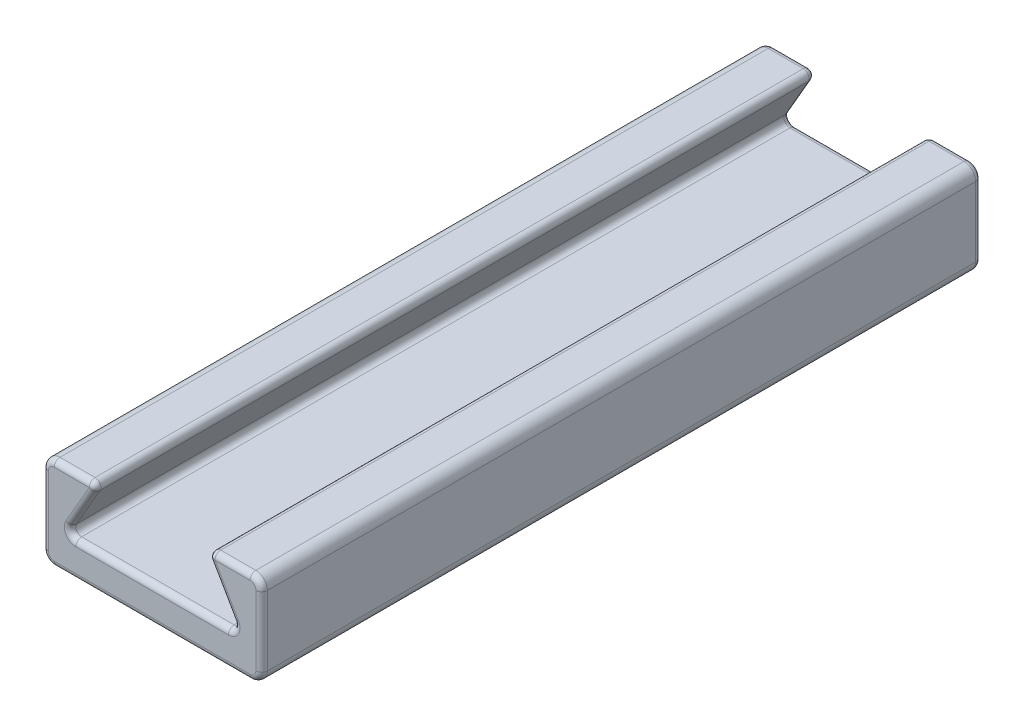
from build123d import *

# Parameters (mm, degrees)
SKETCH1_W           = 5
SKETCH1_H           = 2
BOSS_EXTRUDE1_DEPTH = 62
FILLET1_R           = 0.5
FILLET2_R           = 1
FILLET3_R           = 0.5


with BuildPart() as part:
    # Sketch1 → Boss-Extrude1 (new body)
    with BuildSketch(Plane(origin=(0, 0, 0), x_dir=(0, 1, 0), z_dir=(0, 0, 1))):
        with Locations((-2.5, -1)):
            Rectangle(SKETCH1_W, SKETCH1_H)
        Polygon((0, -4.886751346), (0, -2), (-5, -2), align=None)
        Polygon((-5, -16.87062059), (-5, -2), (-5, 0), (-8, 0), (-8, -18.87062059), (-5, -18.87062059), align=None)
        Polygon((0, -13.983869244), (-5, -16.87062059), (0, -16.87062059), align=None)
        with Locations((-2.5, -17.87062059)):
            Rectangle(SKETCH1_W, SKETCH1_H)
    extrude(amount=BOSS_EXTRUDE1_DEPTH)

    # Fillet1
    fillet1_edges = [part.edges().sort_by_distance(p)[0] for p in [
        (4.886751346, 0, 31),
        (2, -5, 31),
        (16.87062059, -5, 31),
        (13.983869244, 0, 31),
    ]]
    fillet(fillet1_edges, radius=FILLET1_R)

    # Fillet2
    fillet2_edges = [part.edges().sort_by_distance(p)[0] for p in [
        (18.87062059, 0, 31),
        (18.87062059, -8, 31),
        (0, -8, 31),
        (0, 0, 31),
    ]]
    fillet(fillet2_edges, radius=FILLET2_R)

    # Fillet3
    fillet3_edges = [part.edges().sort_by_distance(p)[0] for p in [
        (9.435310295, -5, 0),
        (9.435310295, -5, 62),
        (15.427244917, -2.5, 0),
        (15.427244917, -2.5, 62),
        (3.443375673, -2.5, 0),
        (3.443375673, -2.5, 62),
        (4.453738644, -0.25, 0),
        (14.416881946, -0.25, 0),
        (4.453738644, -0.25, 62),
        (14.416881946, -0.25, 62),
        (16.437607888, -4.75, 0),
        (16.437607888, -4.75, 62),
        (2.433012702, -4.75, 0),
        (2.433012702, -4.75, 62),
        (16.360257619, 0, 0),
        (16.360257619, 0, 62),
        (18.87062059, -4, 0),
        (9.435310295, -8, 0),
        (0, -4, 0),
        (2.510362971, 0, 0),
        (0.292893219, -0.292893219, 0),
        (0.292893219, -7.707106781, 0),
        (18.577727371, -7.707106781, 0),
        (18.577727371, -0.292893219, 0),
        (18.87062059, -4, 62),
        (2.510362971, 0, 62),
        (0, -4, 62),
        (9.435310295, -8, 62),
        (0.292893219, -0.292893219, 62),
        (0.292893219, -7.707106781, 62),
        (18.577727371, -7.707106781, 62),
        (18.577727371, -0.292893219, 62),
    ]]
    fillet(fillet3_edges, radius=FILLET3_R)


solid = part.part
